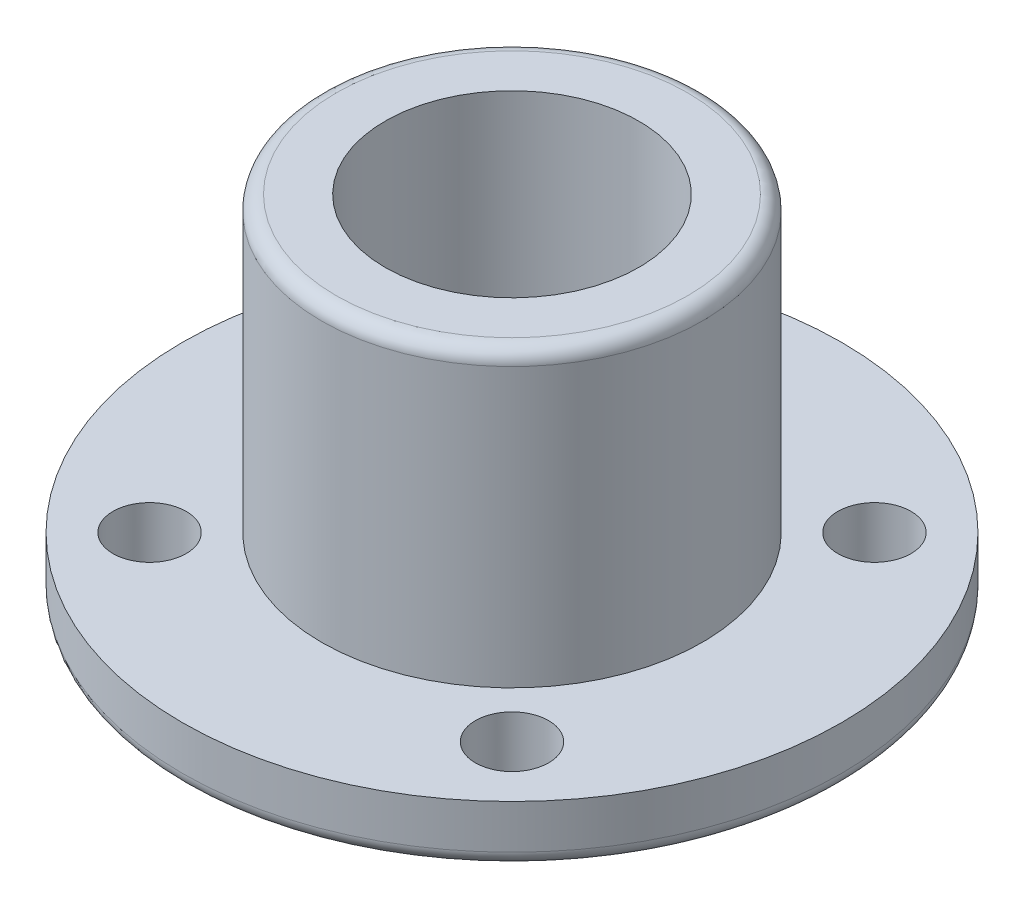
from build123d import *

# Parameters (mm, degrees)
SKETCH1_R                       = 28.575
BOSS_EXTRUDE1_DEPTH             = 5.08
SKETCH2_R                       = 16.51
BOSS_EXTRUDE2_DEPTH             = 25.4
F_1_4_0_25_DIAMETER_HOLE1_D     = 6.35
F_1_4_0_25_DIAMETER_HOLE1_DEPTH = 8.89
F_1_4_0_25_DIAMETER_HOLE1_TIP   = 1.907732465
CUT_EXTRUDE1_DEPTH              = 51.617108274
CUT_EXTRUDE1_DEPTH_BACK         = 51.617108274
SKETCH5_R                       = 11
FILLET1_R                       = 1.27


with BuildPart() as part:
    # Sketch1 → Boss-Extrude1 (new body)
    with BuildSketch(Plane(origin=(0, 0, 0), x_dir=(1, 0, 0), z_dir=(0, 1, 0))):
        with Locations(Location((0, 0, 0), (0, 0, 270))):
            Circle(SKETCH1_R)
    extrude(amount=BOSS_EXTRUDE1_DEPTH)

    # Sketch2 → Boss-Extrude2 (add)
    with BuildSketch(Plane(origin=(0, 5.08, 0), x_dir=(1, 0, 0), z_dir=(0, 1, 0))):
        with Locations(Location((0, 0, 0), (0, 0, 270))):
            Circle(SKETCH2_R)
    extrude(amount=BOSS_EXTRUDE2_DEPTH)

    # 1/4 (0.25) Diameter Hole1
    with Locations(Plane(origin=(0, 0, 0), x_dir=(-1, 0, 0), z_dir=(0, -1, 0))):
        with Locations((15.715448212, 15.715448212), (-15.715448212, 15.715448212), (-15.715448212, -15.715448212), (15.715448212, -15.715448212)):
            Hole(F_1_4_0_25_DIAMETER_HOLE1_D / 2, depth=F_1_4_0_25_DIAMETER_HOLE1_DEPTH)
            with Locations((0, 0, -(F_1_4_0_25_DIAMETER_HOLE1_DEPTH + F_1_4_0_25_DIAMETER_HOLE1_TIP / 2))):  # 118° drill point
                Cone(0, F_1_4_0_25_DIAMETER_HOLE1_D / 2, F_1_4_0_25_DIAMETER_HOLE1_TIP, mode=Mode.SUBTRACT)

    # Sketch5 → Cut-Extrude1 (cut, two sides: drawn at the far end of the back side and taken through both)
    with BuildSketch(Plane(origin=(0, 30.48, 0), x_dir=(1, 0, 0), z_dir=(0, 1, 0)).offset(-CUT_EXTRUDE1_DEPTH_BACK)):
        with Locations(Location((0, 0, 0), (0, 0, 270))):
            Circle(SKETCH5_R)
    extrude(amount=CUT_EXTRUDE1_DEPTH + CUT_EXTRUDE1_DEPTH_BACK, mode=Mode.SUBTRACT)

    # Fillet1
    fillet1_edges = [part.edges().sort_by_distance(p)[0] for p in [
        (0, 0, -28.575),
        (0, 30.48, -16.51),
    ]]
    fillet(fillet1_edges, radius=FILLET1_R)


solid = part.part
